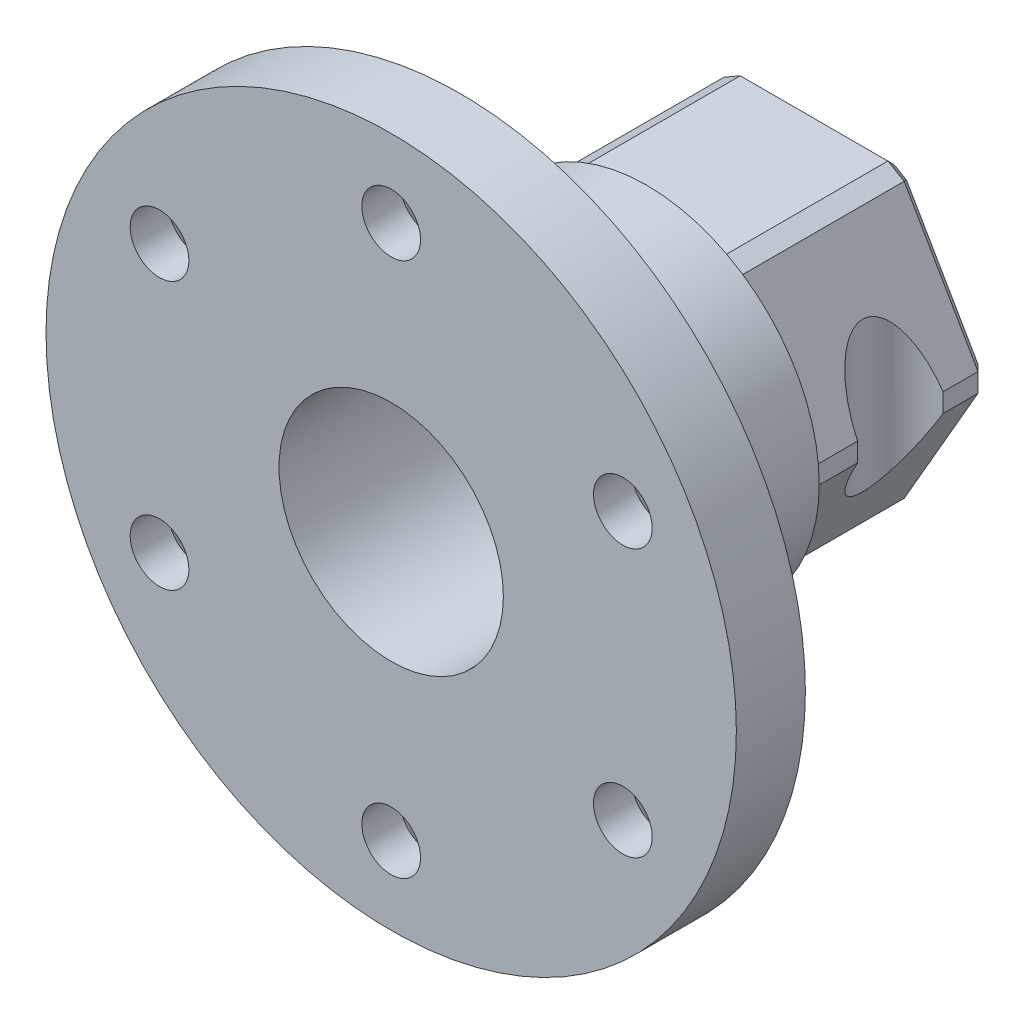
from build123d import *

# Parameters (mm, degrees)
BOSS_EXTRUDE1_DEPTH                                  = 10
F_5_0MM_DOWEL_HOLE1_D                                = 5
F_5_0MM_DOWEL_HOLE1_CSINK_D                          = 5.05
F_5_0MM_DOWEL_HOLE1_CSINK_ANGLE                      = 90
SKETCH5_R                                            = 10
BOSS_EXTRUDE2_DEPTH                                  = 10
SKETCH6_R                                            = 11.5
BOSS_EXTRUDE3_DEPTH                                  = 1
SKETCH7_R                                            = 20
BOSS_EXTRUDE4_DEPTH                                  = 4
CSK_FOR_M3_HEX_SOCKET_COUNTERSUNK_HEAD_S_D           = 3.4
CSK_FOR_M3_HEX_SOCKET_COUNTERSUNK_HEAD_S_CSINK_D     = 6.94
CSK_FOR_M3_HEX_SOCKET_COUNTERSUNK_HEAD_S_CSINK_ANGLE = 90
F_13_0_13_DIAMETER_HOLE1_D                           = 13
SKETCH12_R                                           = 10
CUT_EXTRUDE1_DEPTH                                   = 0.2
CUT_EXTRUDE2_START                                   = -10.2
CUT_EXTRUDE2_DEPTH                                   = 10.2
CHAMFER1_SIZE                                        = 0.5


with BuildPart() as part:
    # Sketch1 → Boss-Extrude1 (new body)
    with BuildSketch(Plane.XY):
        Polygon((-4.907477288, 8.5), (-9.814954576, 0), (-4.907477288, -8.5), (4.907477288, -8.5), (9.814954576, 0), (4.907477288, 8.5), align=None)
    extrude(amount=BOSS_EXTRUDE1_DEPTH)

    # Ø5.0mm Dowel Hole1 (through all)
    with Locations(Plane(origin=(0, 8.5, 0), x_dir=(1, 0, 0), z_dir=(0, 1, 0))):
        with Locations((-9.814954576, -5), (9.814954576, -5)):
            CounterSinkHole(F_5_0MM_DOWEL_HOLE1_D / 2, F_5_0MM_DOWEL_HOLE1_CSINK_D / 2, counter_sink_angle=F_5_0MM_DOWEL_HOLE1_CSINK_ANGLE)

    # Sketch5 → Boss-Extrude2 (add)
    with BuildSketch(Plane.XY.offset(10)):
        Circle(SKETCH5_R)
    extrude(amount=BOSS_EXTRUDE2_DEPTH)

    # Sketch6 → Boss-Extrude3 (add)
    with BuildSketch(Plane.XY.offset(20)):
        Circle(SKETCH6_R)
    extrude(amount=BOSS_EXTRUDE3_DEPTH)

    # Sketch7 → Boss-Extrude4 (add)
    with BuildSketch(Plane.XY.offset(21)):
        Circle(SKETCH7_R)
    extrude(amount=BOSS_EXTRUDE4_DEPTH)

    # CSK for M3 Hex Socket Countersunk Head Screw1 (through all)
    with Locations(Plane(origin=(0, 0, 21), x_dir=(-1, 0, 0), z_dir=(0, 0, -1))):
        with Locations((0, 15.5), (13.423393759, 7.75), (13.423393759, -7.75), (0, -15.5), (-13.423393759, -7.75), (-13.423393759, 7.75)):
            CounterSinkHole(CSK_FOR_M3_HEX_SOCKET_COUNTERSUNK_HEAD_S_D / 2, CSK_FOR_M3_HEX_SOCKET_COUNTERSUNK_HEAD_S_CSINK_D / 2, counter_sink_angle=CSK_FOR_M3_HEX_SOCKET_COUNTERSUNK_HEAD_S_CSINK_ANGLE)

    # Ø13.0 (13) Diameter Hole1 (through all)
    with Locations(Plane.XY.offset(25)):
        with Locations((0, 0)):
            Hole(F_13_0_13_DIAMETER_HOLE1_D / 2)

    # Sketch12 → Cut-Extrude1 (cut)
    with BuildSketch(Plane(origin=(0, 0, 10), x_dir=(-1, 0, 0), z_dir=(0, 0, -1))):
        Circle(SKETCH12_R)
        Polygon((4.907477288, 8.5), (-4.907477288, 8.5), (-9.814954576, 0), (-4.907477288, -8.5), (4.907477288, -8.5), (9.814954576, 0), align=None, mode=Mode.SUBTRACT)
    extrude(amount=-CUT_EXTRUDE1_DEPTH, mode=Mode.SUBTRACT)

    # Sketch13 → Cut-Extrude2 (cut)
    with BuildSketch(Plane(origin=(0, 0, 0), x_dir=(-1, 0, 0), z_dir=(0, 0, -1)).offset(CUT_EXTRUDE2_START)):
        Polygon((-5.222431864, 7.954482672), (-4.277568136, 8.5), (-4.907477288, 8.5), align=None)
        Polygon((4.907477288, 8.5), (4.277568136, 8.5), (5.222431864, 7.954482672), align=None)
        Polygon((-9.5, -0.545517328), (-9.5, 0.545517328), (-9.814954576, 0), align=None)
        Polygon((9.814954576, 0), (9.5, 0.545517328), (9.5, -0.545517328), align=None)
        Polygon((-4.277568136, -8.5), (-5.222431864, -7.954482672), (-4.907477288, -8.5), align=None)
        Polygon((4.907477288, -8.5), (5.222431864, -7.954482672), (4.277568136, -8.5), align=None)
    extrude(amount=CUT_EXTRUDE2_DEPTH, mode=Mode.SUBTRACT)

    # Chamfer1
    chamfer1_edges = [part.edges().sort_by_distance(p)[0] for p in [
        (6.5, 0, 0),
        (0, 8.5, 0),
        (7.361215932, 4.25, 0),
        (7.361215932, -4.25, 0),
        (0, -8.5, 0),
        (-7.361215932, -4.25, 0),
        (-7.361215932, 4.25, 0),
        (9.5, 0, 0),
        (4.75, -8.227241336, 0),
        (-4.75, -8.227241336, 0),
        (-9.5, 0, 0),
        (-4.75, 8.227241336, 0),
        (4.75, 8.227241336, 0),
    ]]
    chamfer(chamfer1_edges, length=CHAMFER1_SIZE)


solid = part.part
